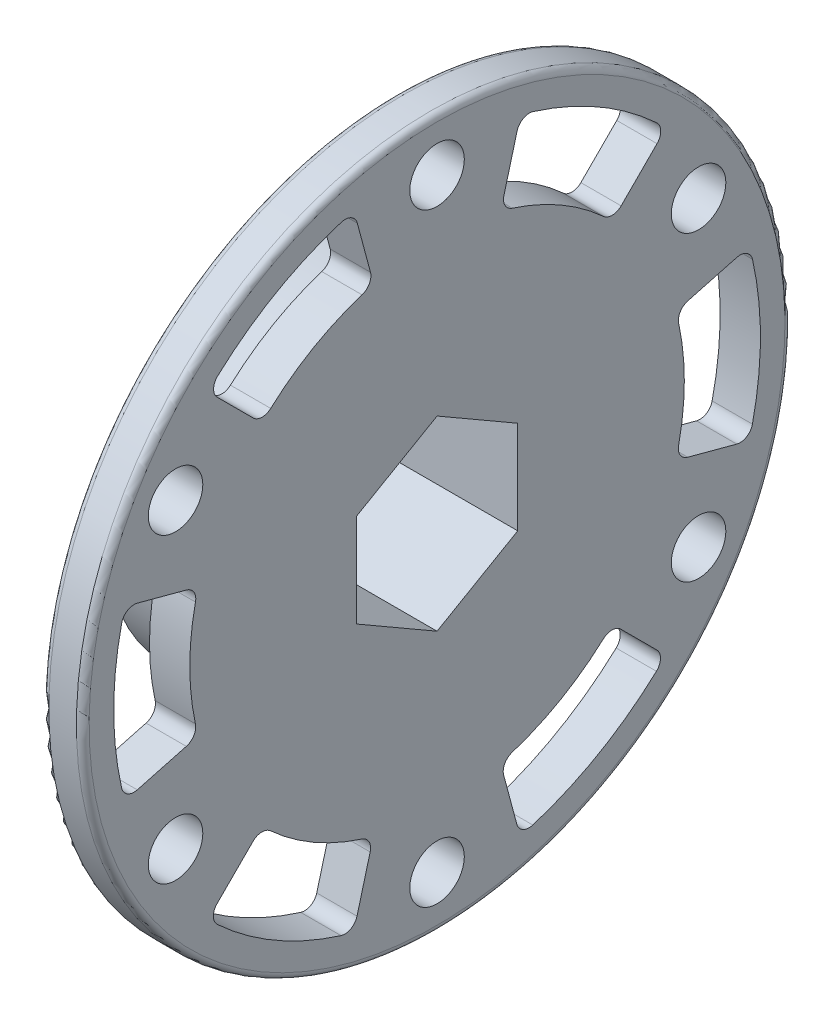
from build123d import *

# Parameters (mm, degrees)
SKETCH1_W           = 3.175
SKETCH1_H           = 27.94
CUT_EXTRUDE1_DEPTH  = 40.640482149
CUT_EXTRUDE2_DEPTH  = 40.640482149
CUT_EXTRUDE3_DEPTH  = 40.640482149
CUT_EXTRUDE4_DEPTH  = 40.640482149
CUT_EXTRUDE5_DEPTH  = 40.640482149
CUT_EXTRUDE6_DEPTH  = 40.640482149
SKETCH8_R           = 14.294919975
BOSS_EXTRUDE1_DEPTH = 9.525
CUT_EXTRUDE7_DEPTH  = 42.503941981
SKETCH10_W          = 3.175
SKETCH10_H          = 2.15
SKETCH11_W          = 3.175
SKETCH11_H          = 2.15
SKETCH12_W          = 3.175
SKETCH12_H          = 2.15
SKETCH13_W          = 3.175
SKETCH13_H          = 2.15
SKETCH14_W          = 3.175
SKETCH14_H          = 2.15
SKETCH15_W          = 3.175
SKETCH15_H          = 2.15
CHAMFER1_SIZE       = 1
FILLET1_R           = 0.5
FILLET2_R           = 1
FILLET3_R           = 1.27


with BuildPart() as part:
    # Sketch1 → Revolve1 (revolve)
    with BuildSketch(Plane(origin=(0, 0, 0), x_dir=(-1, 0, 0), z_dir=(0, 0, -1)), mode=Mode.PRIVATE) as revolve1_sk:
        with Locations((-11.1125, 13.97)):
            Rectangle(SKETCH1_W, SKETCH1_H)
    revolve(revolve1_sk.sketch.rotate(Axis((12.7, 0, 0), (-1, 0, 0)), 180), axis=Axis((12.7, 0, 0), (-1, 0, 0)))

    # Sketch2 → Cut-Extrude1 (cut, through all)
    with BuildSketch(Plane.ZY.offset(-9.525)):
        with BuildLine():
            Line((-13.806531048, -13.770610024), (-18.049174487, -18.013253463))
            ThreePointArc((-18.049174487, -18.013253463), (-12.738999884, -22.089995065), (-6.550803522, -24.644207701))
            Line((-6.550803522, -24.644207701), (-4.997885221, -18.848637704))
            ThreePointArc((-4.997885221, -18.848637704), (-9.738999389, -16.893841804), (-13.806531048, -13.770610024))
        make_face()
    extrude(amount=-CUT_EXTRUDE1_DEPTH, mode=Mode.SUBTRACT)

    # Sketch3 → Cut-Extrude2 (cut, through all)
    with BuildSketch(Plane.ZY.offset(-9.525)):
        with BuildLine():
            Line((5.022432582, -18.842111637), (6.57534786, -24.637670355))
            ThreePointArc((6.57534786, -24.637670355), (12.760996954, -22.077295051), (18.067108165, -17.995266116))
            Line((18.067108165, -17.995266116), (13.824456468, -13.752614419))
            ThreePointArc((13.824456468, -13.752614419), (9.760996476, -16.88114178), (5.022432582, -18.842111637))
        make_face()
    extrude(amount=-CUT_EXTRUDE2_DEPTH, mode=Mode.SUBTRACT)

    # Sketch4 → Cut-Extrude3 (cut, through all)
    with BuildSketch(Plane.ZY.offset(-9.525)):
        with BuildLine():
            Line((18.82896363, -5.071501614), (24.624522347, -6.624416892))
            ThreePointArc((24.624522347, -6.624416892), (25.499996837, 0.012700014), (24.617911686, 6.648941586))
            Line((24.617911686, 6.648941586), (18.822341689, 5.096023285))
            ThreePointArc((18.822341689, 5.096023285), (19.499995864, 0.012700024), (18.82896363, -5.071501614))
        make_face()
    extrude(amount=-CUT_EXTRUDE3_DEPTH, mode=Mode.SUBTRACT)

    # Sketch5 → Cut-Extrude4 (cut, through all)
    with BuildSketch(Plane.ZY.offset(-9.525)):
        with BuildLine():
            Line((13.806531048, 13.770610024), (18.049174487, 18.013253463))
            ThreePointArc((18.049174487, 18.013253463), (12.738999884, 22.089995065), (6.550803522, 24.644207701))
            Line((6.550803522, 24.644207701), (4.997885221, 18.848637704))
            ThreePointArc((4.997885221, 18.848637704), (9.738999389, 16.893841804), (13.806531048, 13.770610024))
        make_face()
    extrude(amount=-CUT_EXTRUDE4_DEPTH, mode=Mode.SUBTRACT)

    # Sketch6 → Cut-Extrude5 (cut, through all)
    with BuildSketch(Plane.ZY.offset(-9.525)):
        with BuildLine():
            Line((-24.617911686, -6.648941586), (-18.822341689, -5.096023285))
            ThreePointArc((-18.822341689, -5.096023285), (-19.499995864, -0.012700024), (-18.82896363, 5.071501614))
            Line((-18.82896363, 5.071501614), (-24.624522347, 6.624416892))
            ThreePointArc((-24.624522347, 6.624416892), (-25.499996837, -0.012700014), (-24.617911686, -6.648941586))
        make_face()
    extrude(amount=-CUT_EXTRUDE5_DEPTH, mode=Mode.SUBTRACT)

    # Sketch7 → Cut-Extrude6 (cut, through all)
    with BuildSketch(Plane(origin=(12.7, 0, 0), x_dir=(0, 0, -1), z_dir=(1, 0, 0))):
        with BuildLine():
            Line((6.57534786, 24.637670355), (5.022432582, 18.842111637))
            ThreePointArc((5.022432582, 18.842111637), (9.760996476, 16.88114178), (13.824456468, 13.752614419))
            Line((13.824456468, 13.752614419), (18.067108165, 17.995266116))
            ThreePointArc((18.067108165, 17.995266116), (12.760996954, 22.077295051), (6.57534786, 24.637670355))
        make_face()
    extrude(amount=-CUT_EXTRUDE6_DEPTH, mode=Mode.SUBTRACT)

    # Sketch8 → Boss-Extrude1 (add)
    with BuildSketch(Plane.ZY.offset(-9.525)):
        with Locations(Location((0, 0, 0), (0, 0, 270))):
            Circle(SKETCH8_R)
    extrude(amount=BOSS_EXTRUDE1_DEPTH)

    # Sketch9 → Cut-Extrude7 (cut, through all)
    with BuildSketch(Plane(origin=(12.7, 0, 0), x_dir=(0, 0, -1), z_dir=(1, 0, 0))):
        Polygon((-6.3627, 3.673506558), (-6.3627, -3.673506558), (0, -7.347013116), (6.3627, -3.673506558), (6.3627, 3.673506558), (0, 7.347013116), align=None)
    extrude(amount=-CUT_EXTRUDE7_DEPTH, mode=Mode.SUBTRACT)

    # Sketch10 → Cut-Revolve1 (revolve, cut)
    with BuildSketch(Plane.XY, mode=Mode.PRIVATE) as cut_revolve1_sk:
        with Locations((11.1125, 24.8875)):
            Rectangle(SKETCH10_W, SKETCH10_H)
    revolve(cut_revolve1_sk.sketch.rotate(Axis((9.525, 23.8125, 0), (1, 0, 0)), 270), axis=Axis((9.525, 23.8125, 0), (1, 0, 0)), mode=Mode.SUBTRACT)

    # Sketch11 → Cut-Revolve2 (revolve, cut)
    with BuildSketch(Plane.XY.offset(20.622229928), mode=Mode.PRIVATE) as cut_revolve2_sk:
        with Locations((11.1125, 12.98125)):
            Rectangle(SKETCH11_W, SKETCH11_H)
    revolve(cut_revolve2_sk.sketch.rotate(Axis((9.525, 11.90625, 20.622229928), (1, 0, 0)), 270), axis=Axis((9.525, 11.90625, 20.622229928), (1, 0, 0)), mode=Mode.SUBTRACT)

    # Sketch12 → Cut-Revolve3 (revolve, cut)
    with BuildSketch(Plane.XY.offset(20.622229928)):
        with Locations((11.1125, -10.83125)):
            Rectangle(SKETCH12_W, SKETCH12_H)
    revolve(axis=Axis((9.525, -11.90625, 20.622229928), (1, 0, 0)), mode=Mode.SUBTRACT)

    # Sketch13 → Cut-Revolve4 (revolve, cut)
    with BuildSketch(Plane.XY, mode=Mode.PRIVATE) as cut_revolve4_sk:
        with Locations((11.1125, -22.7375)):
            Rectangle(SKETCH13_W, SKETCH13_H)
    revolve(cut_revolve4_sk.sketch.rotate(Axis((9.525, -23.8125, 0), (1, 0, 0)), 270), axis=Axis((9.525, -23.8125, 0), (1, 0, 0)), mode=Mode.SUBTRACT)

    # Sketch14 → Cut-Revolve5 (revolve, cut)
    with BuildSketch(Plane.XY.offset(-20.622229928)):
        with Locations((11.1125, -10.83125)):
            Rectangle(SKETCH14_W, SKETCH14_H)
    revolve(axis=Axis((9.525, -11.90625, -20.622229928), (1, 0, 0)), mode=Mode.SUBTRACT)

    # Sketch15 → Cut-Revolve6 (revolve, cut)
    with BuildSketch(Plane.XY.offset(-20.622229928), mode=Mode.PRIVATE) as cut_revolve6_sk:
        with Locations((11.1125, 12.98125)):
            Rectangle(SKETCH15_W, SKETCH15_H)
    revolve(cut_revolve6_sk.sketch.rotate(Axis((9.525, 11.90625, -20.622229928), (1, 0, 0)), 270), axis=Axis((9.525, 11.90625, -20.622229928), (1, 0, 0)), mode=Mode.SUBTRACT)

    # Chamfer1
    chamfer1_edges = [part.edges().sort_by_distance(p)[0] for p in [
        (0, 14.294919975, 0),
    ]]
    chamfer(chamfer1_edges, length=CHAMFER1_SIZE)

    # Fillet1
    fillet1_edges = [part.edges().sort_by_distance(p)[0] for p in [
        (9.525, 27.94, 0),
        (12.7, 27.94, 0),
    ]]
    fillet(fillet1_edges, radius=FILLET1_R)

    # Fillet2
    fillet2_edges = [part.edges().sort_by_distance(p)[0] for p in [
        (11.1125, -13.770610024, -13.806531048),
        (11.1125, -18.848637704, -4.997885221),
        (11.1125, -24.644207701, -6.550803522),
        (11.1125, -18.013253463, -18.049174487),
        (11.1125, -18.842111637, 5.022432582),
        (11.1125, -13.752614419, 13.824456468),
        (11.1125, -17.995266116, 18.067108165),
        (11.1125, -24.637670355, 6.57534786),
        (11.1125, -5.071501614, 18.82896363),
        (11.1125, 5.096023285, 18.822341689),
        (11.1125, 6.648941586, 24.617911686),
        (11.1125, -6.624416892, 24.624522347),
        (11.1125, 13.770610024, 13.806531048),
        (11.1125, 18.848637704, 4.997885221),
        (11.1125, 24.644207701, 6.550803522),
        (11.1125, 18.013253463, 18.049174487),
        (11.1125, -6.648941586, -24.617911686),
        (11.1125, 6.624416892, -24.624522347),
        (11.1125, 5.071501614, -18.82896363),
        (11.1125, -5.096023285, -18.822341689),
        (11.1125, 24.637670355, -6.57534786),
        (11.1125, 17.995266116, -18.067108165),
        (11.1125, 13.752614419, -13.824456468),
        (11.1125, 18.842111637, -5.022432582),
    ]]
    fillet(fillet2_edges, radius=FILLET2_R)

    # Fillet3
    fillet3_edges = [part.edges().sort_by_distance(p)[0] for p in [
        (9.525, 14.294919975, 0),
    ]]
    fillet(fillet3_edges, radius=FILLET3_R)


solid = part.part
